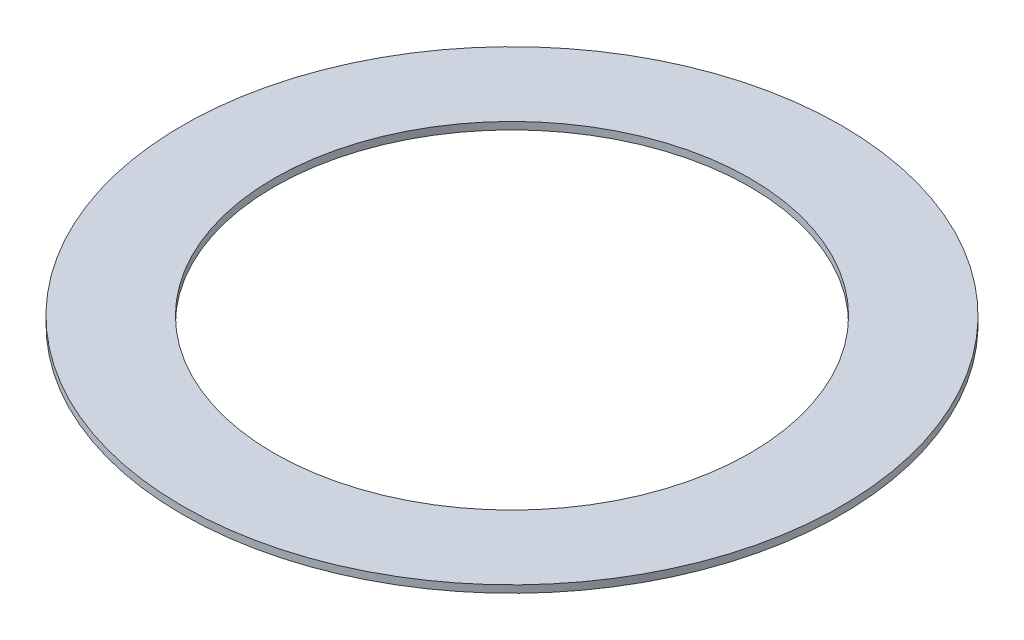
from build123d import *

# Parameters (mm, degrees)
SKETCH_1_R          = 18
EXTRUDE_1_DEPTH     = 0.4
SKETCH_2_R          = 13
CUT_EXTRUDE_1_DEPTH = 0.4


with BuildPart() as part:
    # 草图1 → 凸台-拉伸1 (new body)
    with BuildSketch(Plane(origin=(0, 0, 0), x_dir=(1, 0, 0), z_dir=(0, 1, 0))):
        with Locations(Location((0, 0, 0), (0, 0, 270))):
            Circle(SKETCH_1_R)
    extrude(amount=EXTRUDE_1_DEPTH)

    # 草图2 → 切除-拉伸1 (cut)
    with BuildSketch(Plane(origin=(0, 0.4, 0), x_dir=(1, 0, 0), z_dir=(0, 1, 0))):
        with Locations(Location((0, 0, 0), (0, 0, 270))):
            Circle(SKETCH_2_R)
    extrude(amount=-CUT_EXTRUDE_1_DEPTH, mode=Mode.SUBTRACT)


solid = part.part
